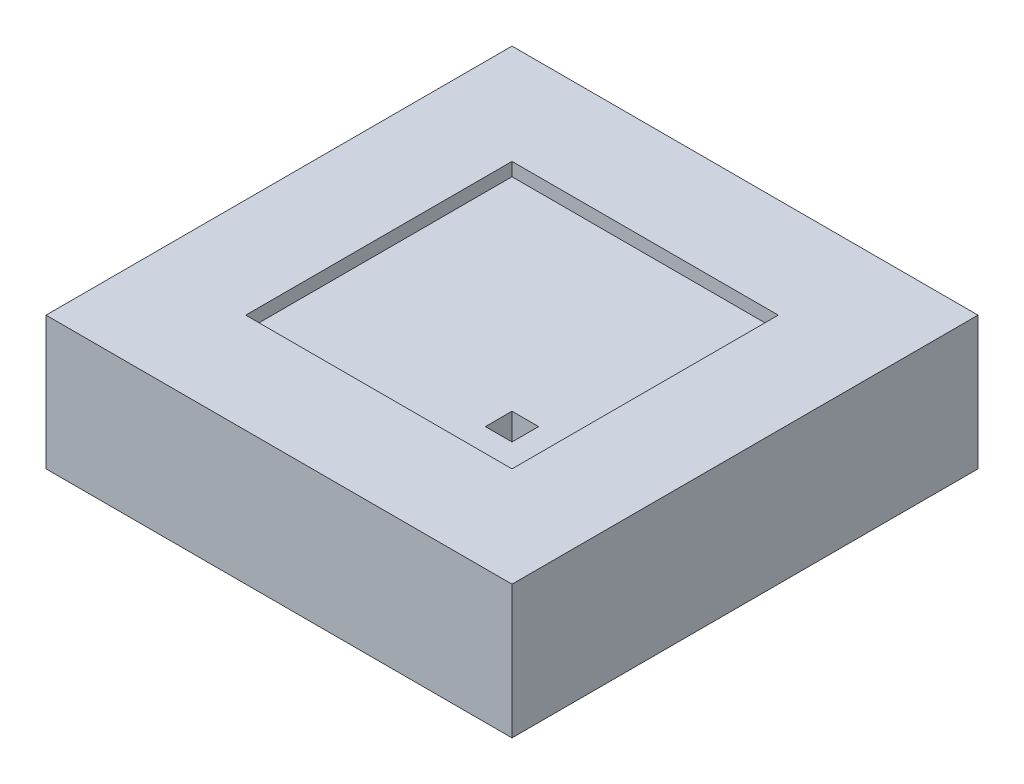
from build123d import *

# Parameters (mm, degrees)
CROQUIS1_W              = 70
CROQUIS1_H              = 70
SALIENTE_EXTRUIR1_DEPTH = 20
CROQUIS2_W              = 40
CROQUIS2_H              = 40
CORTAR_EXTRUIR1_DEPTH   = 2
CROQUIS3_W              = 4
CROQUIS3_H              = 4
CORTAR_EXTRUIR2_DEPTH   = 55


with BuildPart() as part:
    # Croquis1 → Saliente-Extruir1 (new body)
    with BuildSketch(Plane(origin=(0, 0, 0), x_dir=(1, 0, 0), z_dir=(0, 1, 0))):
        with Locations((35, 35)):
            Rectangle(CROQUIS1_W, CROQUIS1_H)
    extrude(amount=SALIENTE_EXTRUIR1_DEPTH)

    # Croquis2 → Cortar-Extruir1 (cut)
    with BuildSketch(Plane(origin=(0, 20, 0), x_dir=(1, 0, 0), z_dir=(0, 1, 0))):
        with Locations((35, 35)):
            Rectangle(CROQUIS2_W, CROQUIS2_H)
    extrude(amount=-CORTAR_EXTRUIR1_DEPTH, mode=Mode.SUBTRACT)

    # Croquis3 → Cortar-Extruir2 (cut)
    with BuildSketch(Plane(origin=(0, 18, 0), x_dir=(1, 0, 0), z_dir=(0, 1, 0))):
        with Locations((47.5, 22.5)):
            Rectangle(CROQUIS3_W, CROQUIS3_H)
    extrude(amount=-CORTAR_EXTRUIR2_DEPTH, mode=Mode.SUBTRACT)


solid = part.part
